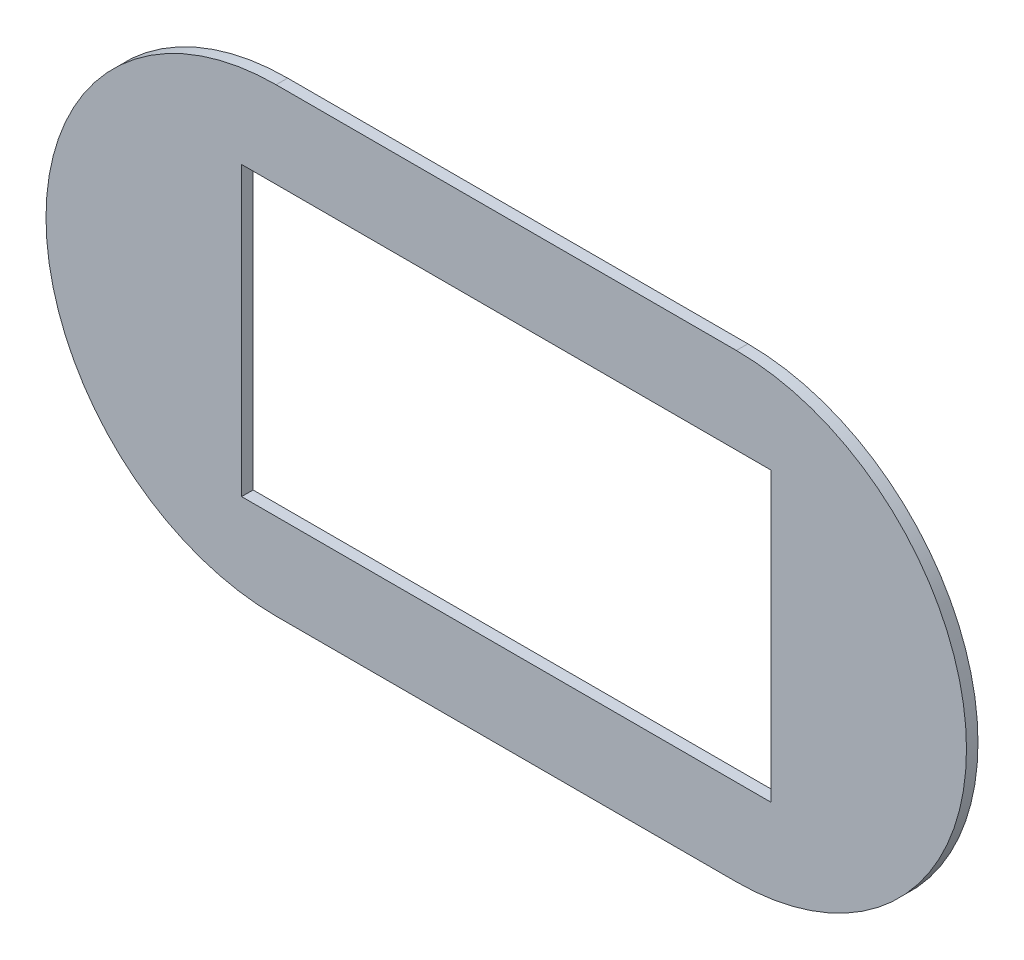
from build123d import *

# Parameters (mm, degrees)
EXTRUDE_1_DEPTH     = 2
SKETCH_2_W          = 92
SKETCH_2_H          = 50
CUT_EXTRUDE_1_DEPTH = 90.465076985


with BuildPart() as part:
    # Эскиз1 → Бобышка-Вытянуть1 (new body)
    with BuildSketch(Plane.XY):
        with BuildLine():
            Line((-40, 40), (40, 40))
            ThreePointArc((40, 40), (80, 0), (40, -40))
            Line((40, -40), (-40, -40))
            ThreePointArc((-40, -40), (-80, 0), (-40, 40))
        make_face()
    extrude(amount=EXTRUDE_1_DEPTH)

    # Эскиз2 → Вырез-Вытянуть1 (cut, through all)
    with BuildSketch(Plane.XY.offset(2)):
        Rectangle(SKETCH_2_W, SKETCH_2_H)
    extrude(amount=-CUT_EXTRUDE_1_DEPTH, mode=Mode.SUBTRACT)


solid = part.part
